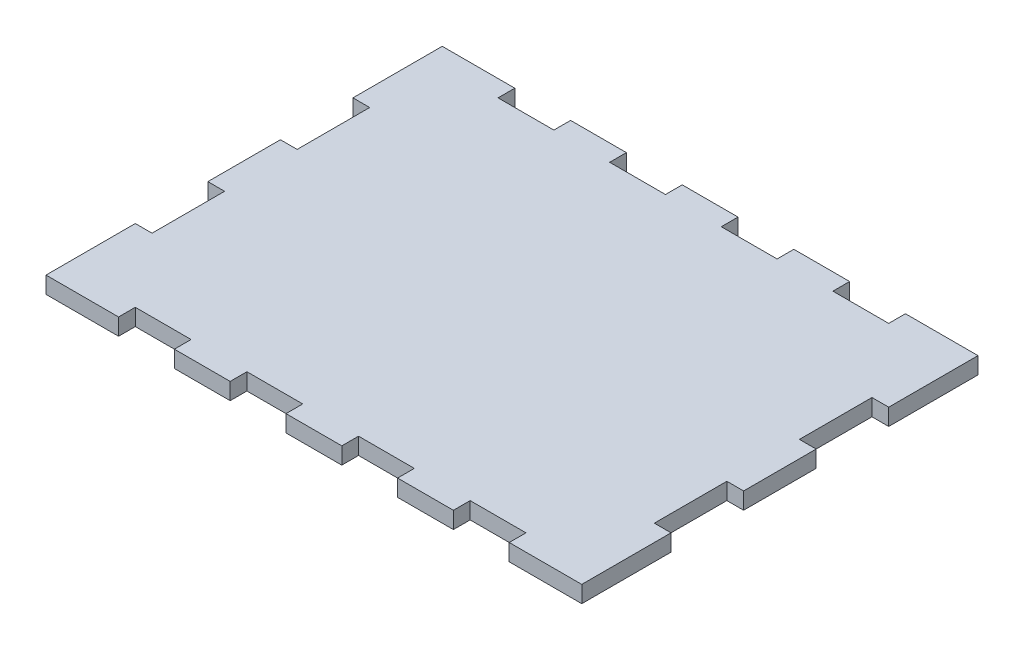
from build123d import *

# Parameters (mm, degrees)
BOSS_EXTRUDE1_DEPTH = 6


with BuildPart() as part:
    # Sketch1 → Boss-Extrude1 (new body)
    with BuildSketch(Plane(origin=(0, 0, 0), x_dir=(1, 0, 0), z_dir=(0, 1, 0))):
        Polygon((-70, 71), (-70, 65), (-50, 65), (-50, 71), (-30, 71), (-30, 65), (-10, 65), (-10, 71), (10, 71), (10, 65), (30, 65), (30, 71), (50, 71), (50, 65), (70, 65), (70, 71), (96, 71), (96, 39), (90, 39), (90, 13), (96, 13), (96, -13), (90, -13), (90, -39), (96, -39), (96, -71), (70, -71), (70, -65), (50, -65), (50, -71), (30, -71), (30, -65), (10, -65), (10, -71), (-10, -71), (-10, -65), (-30, -65), (-30, -71), (-50, -71), (-50, -65), (-70, -65), (-70, -71), (-96, -71), (-96, -39), (-90, -39), (-90, -13), (-96, -13), (-96, 13), (-90, 13), (-90, 39), (-96, 39), (-96, 71), align=None)
    extrude(amount=BOSS_EXTRUDE1_DEPTH)


solid = part.part
